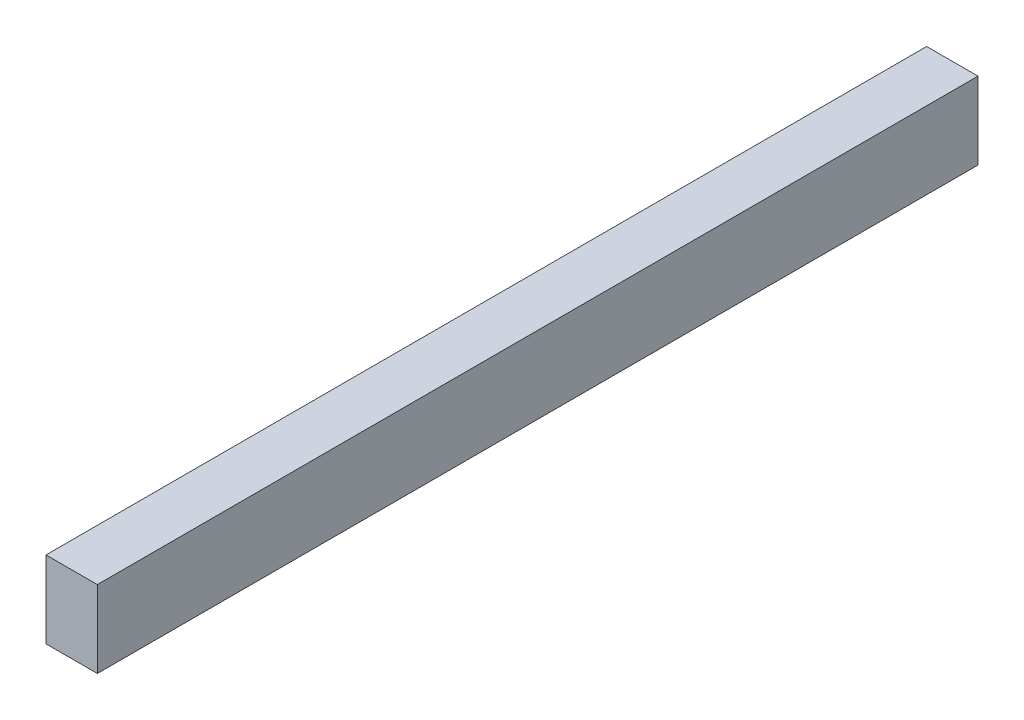
from build123d import *

# Parameters (mm, degrees)
SKETCH1_W           = 50.8
SKETCH1_H           = 76.2
BOSS_EXTRUDE1_DEPTH = 871.22


with BuildPart() as part:
    # Sketch1 → Boss-Extrude1 (new body)
    with BuildSketch(Plane.XY):
        with Locations((25.4, 38.1)):
            Rectangle(SKETCH1_W, SKETCH1_H)
    extrude(amount=BOSS_EXTRUDE1_DEPTH)


solid = part.part
